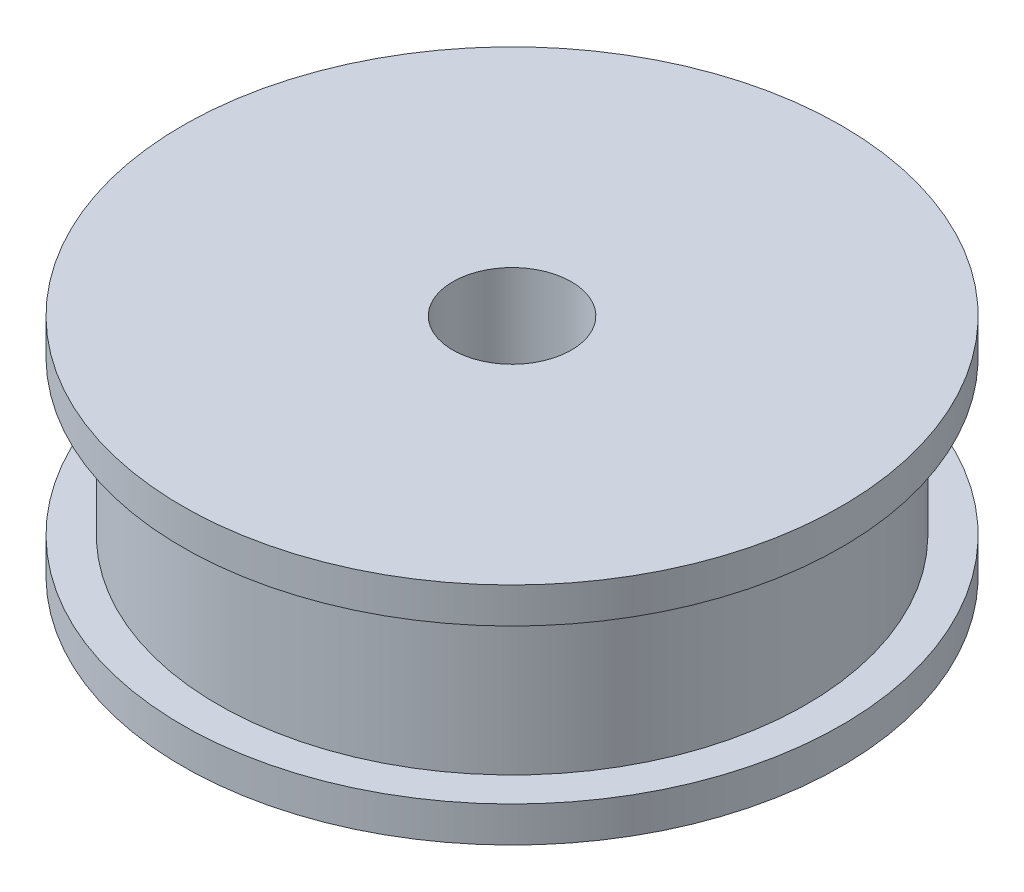
from build123d import *


with BuildPart() as part:
    # Esquisse1 → Révolution1 (revolve)
    with BuildSketch(Plane.XY, mode=Mode.PRIVATE) as r_volution1_sk:
        Polygon((2.5, 0), (13.9, 0), (13.9, 1.5), (12.4, 1.5), (12.4, 8), (13.9, 8), (13.9, 9.5), (2.5, 9.5), align=None)
    revolve(r_volution1_sk.sketch.rotate(Axis((0, 0, 0), (0, 1, 0)), 90), axis=Axis((0, 0, 0), (0, 1, 0)))


solid = part.part
